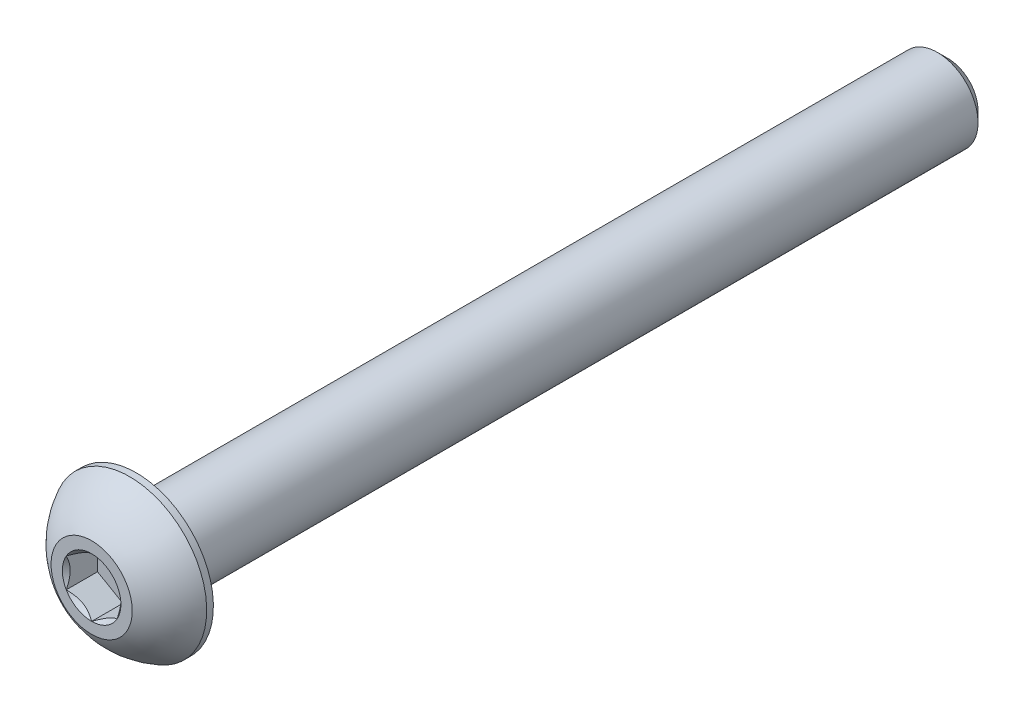
from build123d import *

# Parameters (mm, degrees)
CUT_EXTRUDE2_DEPTH = 1.54


with BuildPart() as part:
    # Sketch10 → Revolve3 (revolve)
    with BuildSketch(Plane(origin=(0, 0, 0), x_dir=(0, 0, -1), z_dir=(1, 0, 0))):
        Polygon((19.475, 2), (20, 1.475), (20, 0), (-20, 0), (-20, 2), align=None)
    revolve(axis=Axis((0, 0, 22.2), (0, 0, -1)))

    # Sketch7 → Revolve2 (revolve)
    with BuildSketch(Plane(origin=(0, 0, 0), x_dir=(0, 0, -1), z_dir=(1, 0, 0))):
        with BuildLine():
            Line((-20.33, 3.8), (-20, 3.8))
            Line((-20, 3.8), (-20, 0))
            Line((-20, 0), (-22.2, 0))
            Line((-22.2, 0), (-22.2, 2))
            ThreePointArc((-22.2, 2), (-21.406499853, 3.047002626), (-20.33, 3.8))
        make_face()
    revolve(axis=Axis((0, 0, 22.2), (0, 0, -1)))

    # Sketch5 → Cut-Extrude2 (cut)
    with BuildSketch(Plane.XY.offset(22.2)):
        Polygon((1.25, -0.721687836), (1.25, 0.721687836), (0, 1.443375673), (-1.25, 0.721687836), (-1.25, -0.721687836), (0, -1.443375673), align=None)
    extrude(amount=-CUT_EXTRUDE2_DEPTH, mode=Mode.SUBTRACT)

    # Cut-Extrude3 cone 1 section (through the dimple's axis) → Cut-Extrude3 (revolve, cut)
    with BuildSketch(Plane(origin=(0, 0, 22.2), x_dir=(0, -1, 0), z_dir=(1, 0, 0))):
        Polygon((0, 0), (1.443375673, 0), (0, 1.443375673), align=None)
    revolve(axis=Axis((0, 0, 22.2), (0, 0, -1)), mode=Mode.SUBTRACT)


solid = part.part
